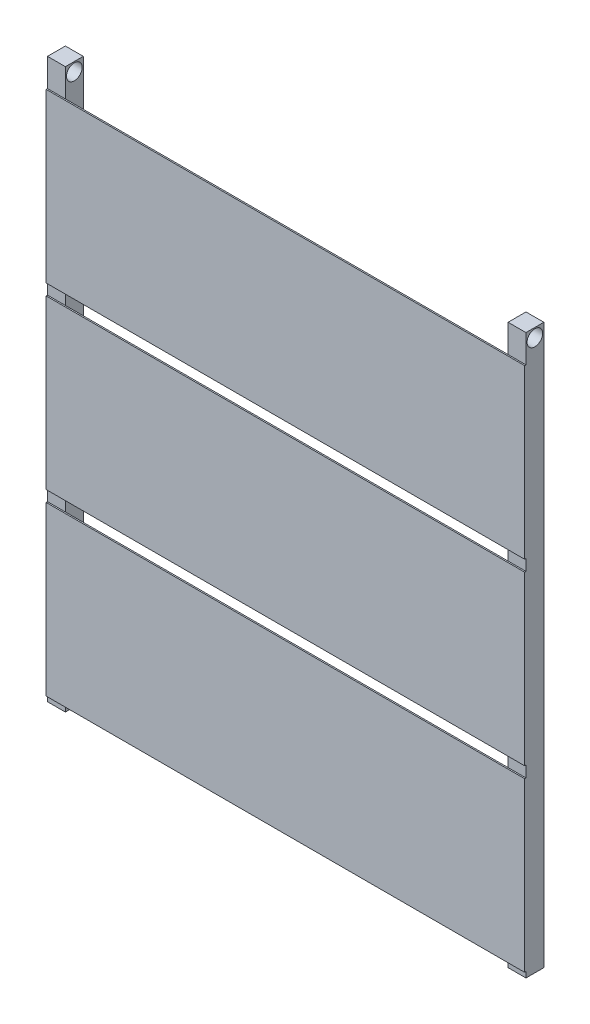
from build123d import *

# Parameters (mm, degrees)
SKETCH1_W               = 16
SKETCH1_H               = 16
BOSS_EXTRUDE1_DEPTH     = 250
BOSS_EXTRUDE1_2_DEPTH   = 250
SKETCH2_W               = 428
SKETCH2_H               = 150
BOSS_EXTRUDE2_DEPTH     = 1.2
CUT_EXTRUDE1_DEPTH      = 483.083123041
CUT_EXTRUDE1_DEPTH_BACK = 483.083123041
SKETCH3_R               = 7


with BuildPart() as part:
    # Sketch1 → Boss-Extrude1 (new, symmetric)
    with BuildSketch(Plane(origin=(0, 0, 0), x_dir=(1, 0, 0), z_dir=(0, 1, 0))):
        with Locations((-206, -3.454545455)):
            Rectangle(SKETCH1_W, SKETCH1_H)
    extrude(amount=BOSS_EXTRUDE1_DEPTH, both=True)


with BuildPart() as body_2:
    # Sketch1 → Boss-Extrude1 2 (new, symmetric)
    with BuildSketch(Plane(origin=(0, 0, 0), x_dir=(1, 0, 0), z_dir=(0, 1, 0))):
        with Locations((206, -3.454545455)):
            Rectangle(SKETCH1_W, SKETCH1_H)
    extrude(amount=BOSS_EXTRUDE1_2_DEPTH, both=True)

    # Sketch2 → Boss-Extrude2 (add)
    with BuildSketch(Plane.XY.offset(11.454545455)):
        with Locations((0, 150)):
            Rectangle(SKETCH2_W, SKETCH2_H)
        with Locations((0, -10)):
            Rectangle(SKETCH2_W, SKETCH2_H)
        with Locations((0, -170)):
            Rectangle(SKETCH2_W, SKETCH2_H)
    extrude(amount=BOSS_EXTRUDE2_DEPTH)


with BuildPart() as cut_extrude1_tool:
    # Sketch3 → Cut-Extrude1 (new, two sides: drawn at the far end of the back side and taken through both)
    with BuildSketch(Plane(origin=(-198, 0, 0), x_dir=(0, 0, -1), z_dir=(1, 0, 0)).offset(-CUT_EXTRUDE1_DEPTH_BACK)):
        with Locations(Location((-3.454545455, 242, 0), (0, 0, 180))):
            Circle(SKETCH3_R)
    extrude(amount=CUT_EXTRUDE1_DEPTH + CUT_EXTRUDE1_DEPTH_BACK)


with BuildPart() as part_1:
    add(part.part)

    # Cut-Extrude1: cut by cut_extrude1_tool
    add(cut_extrude1_tool.part, mode=Mode.SUBTRACT)


with BuildPart() as body_2_1:
    add(body_2.part)

    # Cut-Extrude1: cut by cut_extrude1_tool
    add(cut_extrude1_tool.part, mode=Mode.SUBTRACT)


solid = Compound([part_1.part, body_2_1.part])
